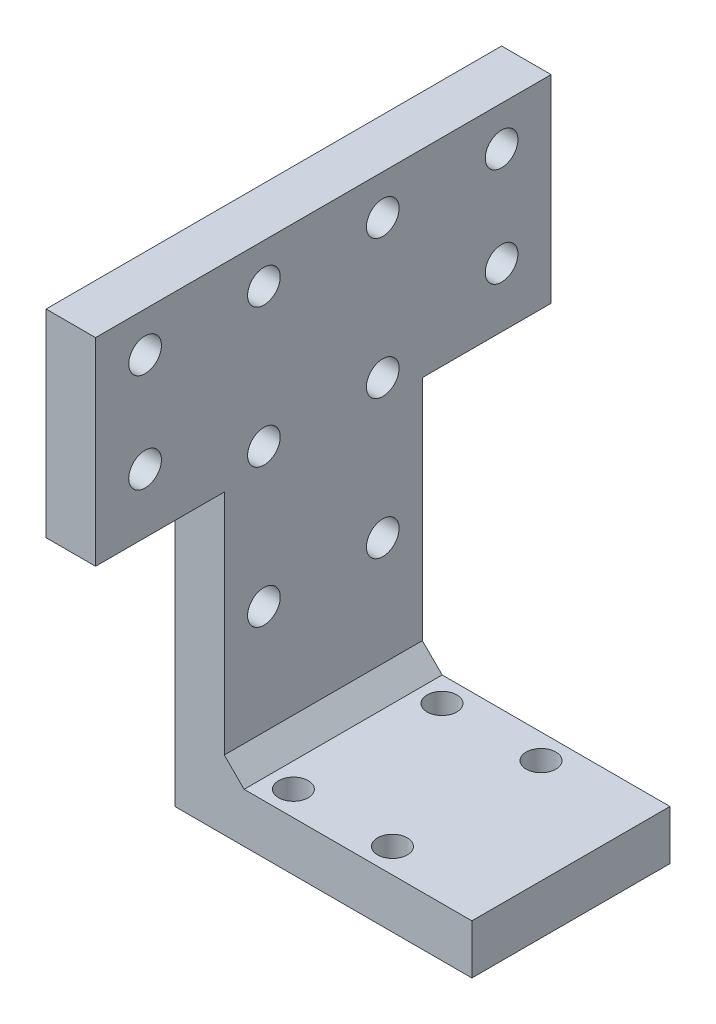
from build123d import *

# Parameters (mm, degrees)
EXTRUDE_1_DEPTH          = 20
CUT_EXTRUDE_2_DEPTH      = 60.371710435
CUT_EXTRUDE_2_DEPTH_BACK = 60.371710435
SKETCH_3_R               = 1.65
SKETCH_4_W               = 13
SKETCH_4_H               = 20
EXTRUDE_2_DEPTH          = 5
CUT_EXTRUDE_3_DEPTH      = 65.915329468
CUT_EXTRUDE_3_DEPTH_BACK = 65.915329468
SKETCH_5_R               = 1.65
CUT_EXTRUDE_6_DEPTH      = 64.356136246
CUT_EXTRUDE_6_DEPTH_BACK = 64.356136246
SKETCH_2_R               = 1.5


with BuildPart() as part:
    # 草图1 → 凸台-拉伸1 (new body)
    with BuildSketch(Plane.XY):
        Polygon((0, 50), (0, 0), (30, 0), (30, 5), (7, 5), (5, 7), (5, 50), align=None)
    extrude(amount=EXTRUDE_1_DEPTH)

    # 草图3 → 切除-拉伸2 (cut, two sides: drawn at the far end of the back side and taken through both)
    with BuildSketch(Plane(origin=(5, 0, 0), x_dir=(0, 0, -1), z_dir=(1, 0, 0)).offset(-CUT_EXTRUDE_2_DEPTH_BACK)):
        with Locations(Location((-4, 46, 0), (0, 0, 90))):
            Circle(SKETCH_3_R)
        with Locations(Location((-16, 46, 0), (0, 0, 90))):
            Circle(SKETCH_3_R)
        with Locations(Location((-4, 32, 0), (0, 0, 90))):
            Circle(SKETCH_3_R)
        with Locations(Location((-16, 32, 0), (0, 0, 90))):
            Circle(SKETCH_3_R)
        with Locations(Location((-16, 18, 0), (0, 0, 90))):
            Circle(SKETCH_3_R)
        with Locations(Location((-4, 18, 0), (0, 0, 90))):
            Circle(SKETCH_3_R)
    extrude(amount=CUT_EXTRUDE_2_DEPTH + CUT_EXTRUDE_2_DEPTH_BACK, mode=Mode.SUBTRACT)

    # 草图4 → 凸台-拉伸2 (add)
    with BuildSketch(Plane.ZY):
        with Locations((26.5, 40)):
            Rectangle(SKETCH_4_W, SKETCH_4_H)
        with Locations((-6.5, 40)):
            Rectangle(SKETCH_4_W, SKETCH_4_H)
    extrude(amount=-EXTRUDE_2_DEPTH)

    # 草图5 → 切除-拉伸3 (cut, two sides: drawn at the far end of the back side and taken through both)
    with BuildSketch(Plane(origin=(5, 0, 0), x_dir=(0, 0, -1), z_dir=(1, 0, 0)).offset(-CUT_EXTRUDE_3_DEPTH_BACK)):
        with Locations(Location((-28, 46, 0), (0, 0, 90))):
            Circle(SKETCH_5_R)
        with Locations(Location((-28, 36, 0), (0, 0, 90))):
            Circle(SKETCH_5_R)
        with Locations(Location((8, 46, 0), (0, 0, 90))):
            Circle(SKETCH_5_R)
        with Locations(Location((8, 36, 0), (0, 0, 90))):
            Circle(SKETCH_5_R)
    extrude(amount=CUT_EXTRUDE_3_DEPTH + CUT_EXTRUDE_3_DEPTH_BACK, mode=Mode.SUBTRACT)

    # 草图2 → 切除-拉伸6 (cut, two sides: drawn at the far end of the back side and taken through both)
    with BuildSketch(Plane(origin=(0, 5, 0), x_dir=(1, 0, 0), z_dir=(0, 1, 0)).offset(-CUT_EXTRUDE_6_DEPTH_BACK)):
        with Locations(Location((9.48, -17.5, 0), (0, 0, 180))):
            Circle(SKETCH_2_R)
        with Locations(Location((19.48, -17.5, 0), (0, 0, 180))):
            Circle(SKETCH_2_R)
        with Locations(Location((19.48, -2.5, 0), (0, 0, 180))):
            Circle(SKETCH_2_R)
        with Locations(Location((9.48, -2.5, 0), (0, 0, 180))):
            Circle(SKETCH_2_R)
    extrude(amount=CUT_EXTRUDE_6_DEPTH + CUT_EXTRUDE_6_DEPTH_BACK, mode=Mode.SUBTRACT)


solid = part.part
